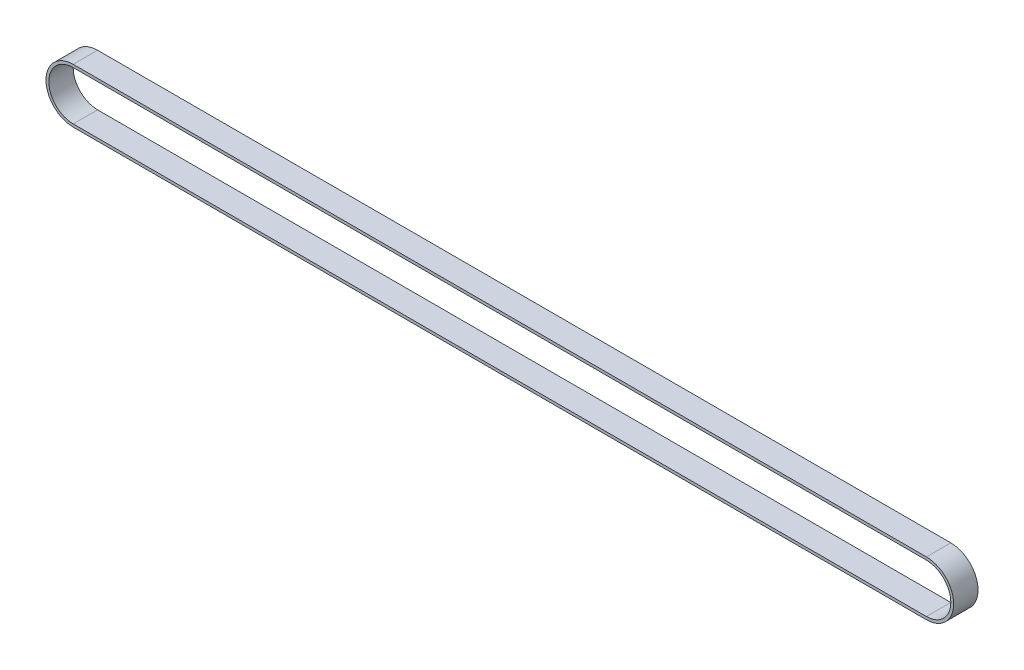
from build123d import *

# Parameters (mm, degrees)
BOSS_EXTRUDE1_DEPTH = 40


with BuildPart() as part:
    # Sketch1 → Boss-Extrude1 (new body)
    with BuildSketch(Plane.XY):
        with BuildLine():
            Line((0, -44.655), (1400, -44.655))
            ThreePointArc((1400, -44.655), (1444.655, 0), (1400, 44.655))
            Line((1400, 44.655), (0, 44.655))
            ThreePointArc((0, 44.655), (-44.655, 0), (0, -44.655))
        make_face()
        with BuildLine():
            Line((1400, -40.055), (0, -40.055))
            ThreePointArc((0, -40.055), (-40.055, 0), (0, 40.055))
            Line((0, 40.055), (1400, 40.055))
            ThreePointArc((1400, 40.055), (1440.055, 0), (1400, -40.055))
        make_face(mode=Mode.SUBTRACT)
    extrude(amount=BOSS_EXTRUDE1_DEPTH)


solid = part.part
